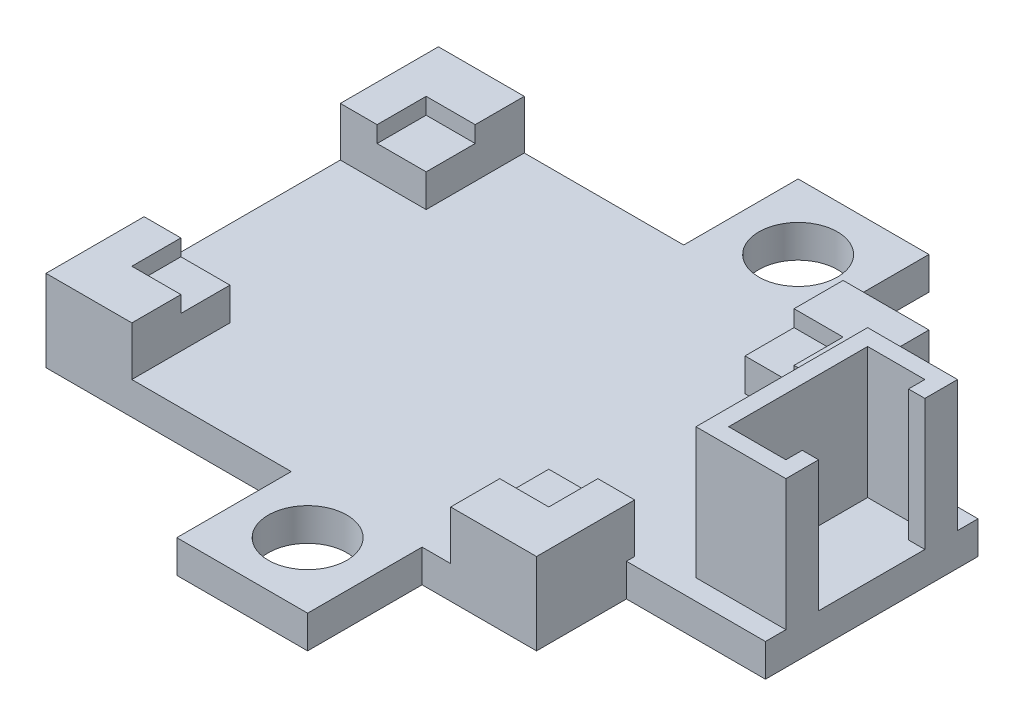
from build123d import *

# Parameters (mm, degrees)
SKETCH_1_W          = 30
SKETCH_1_H          = 24
EXTRUDE_1_DEPTH     = 2
EXTRUDE_2_DEPTH     = 3
SKETCH_3_W          = 3
SKETCH_3_H          = 3
EXTRUDE_3_DEPTH     = 2
SKETCH_4_W          = 24
SKETCH_4_H          = 2
EXTRUDE_4_DEPTH     = 8.5
SKETCH_5_W          = 5.5
SKETCH_5_H          = 10.5
SKETCH_5_W_2        = 3.5
SKETCH_5_H_2        = 8.5
EXTRUDE_5_DEPTH     = 8
SKETCH_6_W          = 1
SKETCH_6_H          = 6.5
CUT_EXTRUDE_1_DEPTH = 8
SKETCH_7_W          = 8.5
SKETCH_7_H          = 5.5
CUT_EXTRUDE_2_DEPTH = 9
SKETCH_8_W          = 8
SKETCH_8_H          = 7
SKETCH_8_R          = 2.4
EXTRUDE_6_DEPTH     = 2


with BuildPart() as part:
    # 草图1 → 凸台-拉伸1 (new body)
    with BuildSketch(Plane(origin=(0, 0, 0), x_dir=(1, 0, 0), z_dir=(0, 1, 0))):
        Rectangle(SKETCH_1_W, SKETCH_1_H)
    extrude(amount=EXTRUDE_1_DEPTH)

    # 草图2 → 凸台-拉伸2 (add)
    with BuildSketch(Plane(origin=(0, 2, 0), x_dir=(1, 0, 0), z_dir=(0, 1, 0))):
        Polygon((-15, 12), (-15, 6), (-12.75, 6), (-12.75, 9), (-9.75, 9), (-9.75, 12), align=None)
        Polygon((9.75, 12), (15, 12), (15, 6), (12.75, 6), (12.75, 9), (9.75, 9), align=None)
        Polygon((15, -12), (15, -6), (12.75, -6), (12.75, -9), (9.75, -9), (9.75, -12), align=None)
        Polygon((-9.75, -12), (-15, -12), (-15, -6), (-12.75, -6), (-12.75, -9), (-9.75, -9), align=None)
    extrude(amount=EXTRUDE_2_DEPTH)

    # 草图3 → 凸台-拉伸3 (add)
    with BuildSketch(Plane(origin=(0, 2, 0), x_dir=(1, 0, 0), z_dir=(0, 1, 0))):
        with Locations((-11.25, 7.5)):
            Rectangle(SKETCH_3_W, SKETCH_3_H)
        with Locations((11.25, 7.5)):
            Rectangle(SKETCH_3_W, SKETCH_3_H)
        with Locations((11.25, -7.5)):
            Rectangle(SKETCH_3_W, SKETCH_3_H)
        with Locations((-11.25, -7.5)):
            Rectangle(SKETCH_3_W, SKETCH_3_H)
    extrude(amount=EXTRUDE_3_DEPTH)

    # 草图4 → 凸台-拉伸4 (add)
    with BuildSketch(Plane(origin=(15, 0, 0), x_dir=(0, 0, -1), z_dir=(1, 0, 0))):
        with Locations((0, 1)):
            Rectangle(SKETCH_4_W, SKETCH_4_H)
    extrude(amount=EXTRUDE_4_DEPTH)

    # 草图5 → 凸台-拉伸5 (add)
    with BuildSketch(Plane(origin=(0, 2, 0), x_dir=(1, 0, 0), z_dir=(0, 1, 0))):
        with Locations((20.75, 0)):
            Rectangle(SKETCH_5_W, SKETCH_5_H)
        with Locations((20.75, 0)):
            Rectangle(SKETCH_5_W_2, SKETCH_5_H_2, mode=Mode.SUBTRACT)
    extrude(amount=EXTRUDE_5_DEPTH)

    # 草图6 → 切除-拉伸1 (cut)
    with BuildSketch(Plane(origin=(0, 10, 0), x_dir=(1, 0, 0), z_dir=(0, 1, 0))):
        with Locations((23, 0)):
            Rectangle(SKETCH_6_W, SKETCH_6_H)
    extrude(amount=-CUT_EXTRUDE_1_DEPTH, mode=Mode.SUBTRACT)

    # 草图7 → 切除-拉伸2 (cut)
    with BuildSketch(Plane(origin=(0, 2, 0), x_dir=(1, 0, 0), z_dir=(0, 1, 0))):
        with Locations((19.25, 9.25)):
            Rectangle(SKETCH_7_W, SKETCH_7_H)
        with Locations((19.25, -9.25)):
            Rectangle(SKETCH_7_W, SKETCH_7_H)
    extrude(amount=-CUT_EXTRUDE_2_DEPTH, mode=Mode.SUBTRACT)

    # 草图8 → 凸台-拉伸6 (add)
    # profile 1 of 2: a face of its own
    with BuildSketch(Plane(origin=(0, 2, 0), x_dir=(1, 0, 0), z_dir=(0, 1, 0))):
        with Locations((4, -15.5)):
            Rectangle(SKETCH_8_W, SKETCH_8_H)
        with Locations(Location((4, -15, 0), (0, 0, 270))):
            Circle(SKETCH_8_R, mode=Mode.SUBTRACT)
    # profile 2 of 2: a face of its own
    with BuildSketch(Plane(origin=(0, 2, 0), x_dir=(1, 0, 0), z_dir=(0, 1, 0))):
        with Locations((4, 15.5)):
            Rectangle(SKETCH_8_W, SKETCH_8_H)
        with Locations(Location((4, 15, 0), (0, 0, 270))):
            Circle(SKETCH_8_R, mode=Mode.SUBTRACT)
    extrude(amount=-EXTRUDE_6_DEPTH)


solid = part.part
